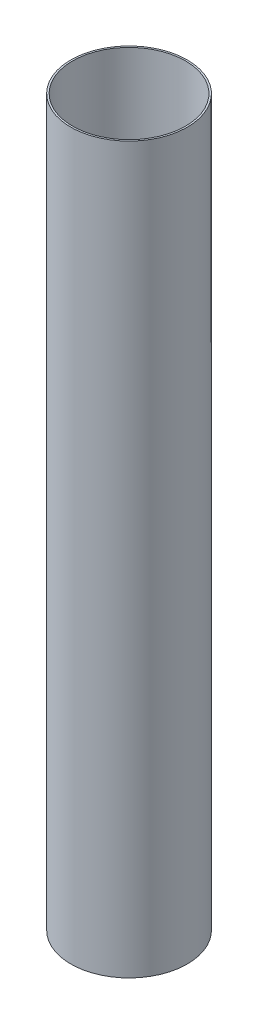
from build123d import *

# Parameters (mm, degrees)
SKETCH1_R           = 51.054
SKETCH1_R_2         = 49.53
BOSS_EXTRUDE1_DEPTH = 635


with BuildPart() as part:
    # Sketch1 → Boss-Extrude1 (new body)
    with BuildSketch(Plane(origin=(0, 150, 0), x_dir=(1, 0, 0), z_dir=(0, 1, 0))):
        with Locations(Location((0, 0, 0), (0, 0, 90))):
            Circle(SKETCH1_R)
        with Locations(Location((0, 0, 0), (0, 0, 90))):
            Circle(SKETCH1_R_2, mode=Mode.SUBTRACT)
    extrude(amount=BOSS_EXTRUDE1_DEPTH)


solid = part.part
